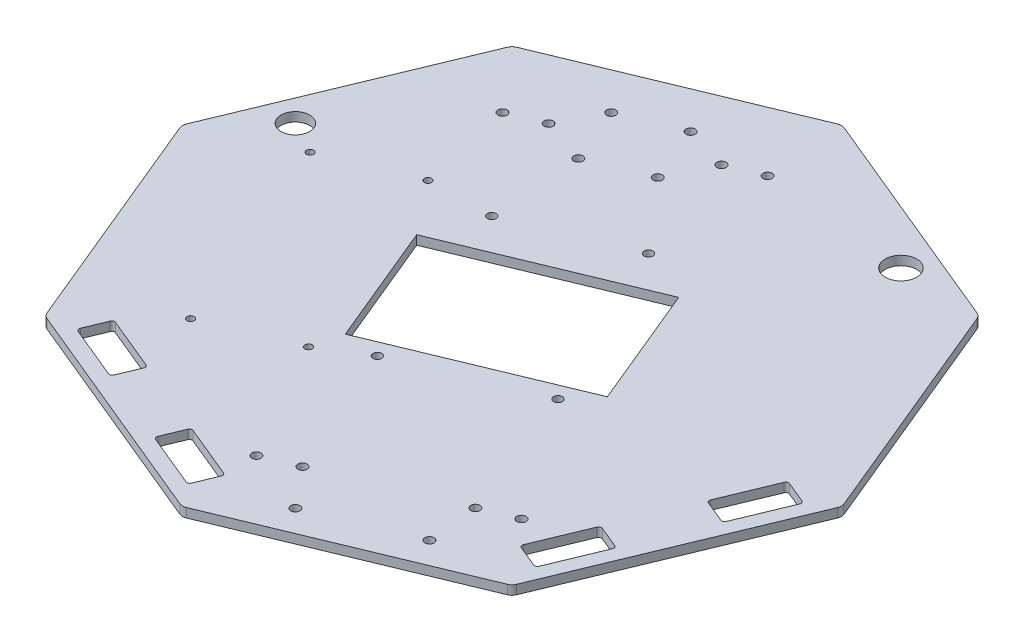
from build123d import *

# Parameters (mm, degrees)
BOSS_EXTRUDE1_DEPTH = 3.175
SKETCH2_R           = 1.6
CUT_EXTRUDE1_DEPTH  = 164.054057029
SKETCH3_R           = 5
SKETCH3_R_2         = 1.6
SKETCH3_R_3         = 5.5
CUT_EXTRUDE2_DEPTH  = 164.054057029
SKETCH5_R           = 1.524
CUT_EXTRUDE3_DEPTH  = 164.054057029
CUT_EXTRUDE4_DEPTH  = 164.054057029
SKETCH8_R           = 1.25
CUT_EXTRUDE5_DEPTH  = 164.054057029
SKETCH9_W           = 27.941695013
SKETCH9_H           = 13.477758771
SKETCH9_W_2         = 30.242775778
SKETCH9_H_2         = 17.203318106
SKETCH9_W_3         = 23.480845259
SKETCH9_H_3         = 15.425198082
SKETCH9_W_4         = 27.275197361
SKETCH9_H_4         = 16.833910872
BOSS_EXTRUDE2_DEPTH = 3.175
SKETCH16_R          = 1.6
CUT_EXTRUDE6_DEPTH  = 10
FILLET1_R           = 3
FILLET2_R           = 1


with BuildPart() as part:
    # Sketch1 → Boss-Extrude1 (new body)
    with BuildSketch(Plane(origin=(0, 0, 0), x_dir=(1, 0, 0), z_dir=(0, 1, 0))):
        Polygon((115.274769331, 0), (81.511571094, 81.511571094), (0, 115.274769331), (-81.511571094, 81.511571094), (-115.274769331, 0), (-81.511571094, -81.511571094), (0, -115.274769331), (81.511571094, -81.511571094), align=None)
    extrude(amount=BOSS_EXTRUDE1_DEPTH)

    # Sketch2 → Cut-Extrude1 (cut, through all)
    with BuildSketch(Plane(origin=(0, 3.175, 0), x_dir=(1, 0, 0), z_dir=(0, 1, 0))):
        with Locations(Location((-8.982761909, 81.788202013, 0), (0, 0, 270))):
            Circle(SKETCH2_R)
        with Locations(Location((3.951551546, 87.145770066, 0), (0, 0, 270))):
            Circle(SKETCH2_R)
        with Locations(Location((-64.41553386, 58.827196071, 0), (0, 0, 90))):
            Circle(SKETCH2_R)
        with Locations(Location((-51.481220405, 64.184764124, 0), (0, 0, 90))):
            Circle(SKETCH2_R)
        with Locations(Location((64.41553386, -58.827196071, 0), (0, 0, 90))):
            Circle(SKETCH2_R)
        with Locations(Location((51.481220405, -64.184764124, 0), (0, 0, 90))):
            Circle(SKETCH2_R)
        with Locations(Location((8.982761909, -81.788202013, 0), (0, 0, 270))):
            Circle(SKETCH2_R)
        with Locations(Location((-3.951551546, -87.145770066, 0), (0, 0, 270))):
            Circle(SKETCH2_R)
    extrude(amount=-CUT_EXTRUDE1_DEPTH, mode=Mode.SUBTRACT)

    # Sketch3 → Cut-Extrude2 (cut, through all)
    with BuildSketch(Plane(origin=(0, 3.175, 0), x_dir=(1, 0, 0), z_dir=(0, 1, 0))):
        with Locations(Location((-96.010047769, 20.377892773, 0), (0, 0, 270))):
            Circle(SKETCH3_R)
        with Locations(Location((20.377892773, -96.010047769, 0), (0, 0, 270))):
            Circle(SKETCH3_R_2)
        with Locations(Location((53.480009673, -82.298702006, 0), (0, 0, 90))):
            Circle(SKETCH3_R_2)
        with Locations(Location((-24.491739671, 86.844676056, 0), (0, 0, 270))):
            Circle(SKETCH3_R_2)
        with Locations(Location((-44.090184145, 78.726734554, 0), (0, 0, 90))):
            Circle(SKETCH3_R_2)
        with Locations(Location((-35.972242642, 59.128290081, 0), (0, 0, 270))):
            Circle(SKETCH3_R_2)
        with Locations(Location((-16.373798169, 67.246231583, 0), (0, 0, 90))):
            Circle(SKETCH3_R_2)
        with Locations(Location((53.480009673, 82.298702006, 0), (0, 0, 270))):
            Circle(SKETCH3_R_3)
        Polygon((-68.117650961, -70.823631462), (-71.944485285, -80.062426787), (-51.944485285, -88.346698034), (-48.117650961, -79.107902709), align=None)
        Polygon((-1.913417162, -98.246322988), (-5.740251485, -107.485118313), (-25.740251485, -99.200847065), (-21.913417162, -89.96205174), align=None)
        Polygon((88.346698034, -51.944485285), (80.062426787, -71.944485285), (70.823631462, -68.117650961), (79.107902709, -48.117650961), align=None)
        Polygon((98.246322988, -1.913417162), (107.485118313, -5.740251485), (99.200847066, -25.740251485), (89.96205174, -21.913417162), align=None)
    extrude(amount=-CUT_EXTRUDE2_DEPTH, mode=Mode.SUBTRACT)

    # Sketch5 → Cut-Extrude3 (cut, through all)
    with BuildSketch(Plane(origin=(0, 3.175, 0), x_dir=(1, 0, 0), z_dir=(0, 1, 0))):
        with Locations(Location((33.228392199, -17.165706419, 0), (0, 0, 270))):
            Circle(SKETCH5_R)
        with Locations(Location((-11.35803404, -35.634008864, 0), (0, 0, 270))):
            Circle(SKETCH5_R)
        with Locations(Location((-33.697130397, 26.59401536, 0), (0, 0, 270))):
            Circle(SKETCH5_R)
        with Locations(Location((5.02266081, 42.632278011, 0), (0, 0, 270))):
            Circle(SKETCH5_R)
    extrude(amount=-CUT_EXTRUDE3_DEPTH, mode=Mode.SUBTRACT)

    # Sketch6 → Cut-Extrude4 (cut, through all)
    with BuildSketch(Plane(origin=(0, 3.175, 0), x_dir=(1, 0, 0), z_dir=(0, 1, 0))):
        Polygon((41.137502582, -7.855309115), (23.534064693, 34.643149381), (-41.137502582, 7.855309115), (-23.534064693, -34.643149381), align=None)
    extrude(amount=-CUT_EXTRUDE4_DEPTH, mode=Mode.SUBTRACT)

    # Sketch8 → Cut-Extrude5 (cut, through all)
    with BuildSketch(Plane(origin=(0, 3.175, 0), x_dir=(1, 0, 0), z_dir=(0, 1, 0))):
        with Locations(Location((-55.208521245, -56.963472567, 0), (0, 0, 270))):
            Circle(SKETCH8_R)
        with Locations(Location((-26.106315971, -44.908944448, 0), (0, 0, 270))):
            Circle(SKETCH8_R)
        with Locations(Location((-84.675145537, 14.175251436, 0), (0, 0, 270))):
            Circle(SKETCH8_R)
        with Locations(Location((-55.572940263, 26.229779555, 0), (0, 0, 270))):
            Circle(SKETCH8_R)
    extrude(amount=-CUT_EXTRUDE5_DEPTH, mode=Mode.SUBTRACT)

    # Sketch9 → Boss-Extrude2 (add)
    with BuildSketch(Plane(origin=(0, 3.175, 0), x_dir=(1, 0, 0), z_dir=(0, 1, 0))):
        with Locations((-58.48921623, 61.487322726)):
            Rectangle(SKETCH9_W, SKETCH9_H)
        with Locations((3.475601533, 82.74492599)):
            Rectangle(SKETCH9_W_2, SKETCH9_H_2)
        with Locations((2.615763969, -84.269263782)):
            Rectangle(SKETCH9_W_3, SKETCH9_H_3)
        with Locations((52.818476628, -60.231828394)):
            Rectangle(SKETCH9_W_4, SKETCH9_H_4)
    extrude(amount=-BOSS_EXTRUDE2_DEPTH)

    # Sketch16 → Cut-Extrude6 (cut)
    with BuildSketch(Plane(origin=(0, 3.175, 0), x_dir=(1, 0, 0), z_dir=(0, 1, 0))):
        with Locations(Location((-51.719028062, 64.497570003, 0), (0, 0, 270))):
            Circle(SKETCH16_R)
        with Locations(Location((-63.082746312, 59.790563785, 0), (0, 0, 270))):
            Circle(SKETCH16_R)
        with Locations(Location((-9.03579366, 82.177544578, 0), (0, 0, 270))):
            Circle(SKETCH16_R)
        with Locations(Location((2.32792459, 86.884550796, 0), (0, 0, 270))):
            Circle(SKETCH16_R)
        with Locations(Location((63.082746312, -59.790563785, 0), (0, 0, 270))):
            Circle(SKETCH16_R)
        with Locations(Location((51.719028062, -64.497570003, 0), (0, 0, 270))):
            Circle(SKETCH16_R)
        with Locations(Location((9.03579366, -82.177544578, 0), (0, 0, 270))):
            Circle(SKETCH16_R)
        with Locations(Location((-2.32792459, -86.884550796, 0), (0, 0, 270))):
            Circle(SKETCH16_R)
    extrude(amount=-CUT_EXTRUDE6_DEPTH, mode=Mode.SUBTRACT)

    # Fillet1
    fillet1_edges = [part.edges().sort_by_distance(p)[0] for p in [
        (81.511571094, 1.5875, 81.511571094),
        (0, 1.5875, 115.274769331),
        (-81.511571094, 1.5875, 81.511571094),
        (-115.274769331, 1.5875, 0),
        (-81.511571094, 1.5875, -81.511571094),
        (0, 1.5875, -115.274769331),
        (81.511571094, 1.5875, -81.511571094),
        (115.274769331, 1.5875, 0),
    ]]
    fillet(fillet1_edges, radius=FILLET1_R)

    # Fillet2
    fillet2_edges = [part.edges().sort_by_distance(p)[0] for p in [
        (79.107902709, 1.5875, 48.117650961),
        (88.346698034, 1.5875, 51.944485285),
        (80.062426787, 1.5875, 71.944485285),
        (70.823631462, 1.5875, 68.117650961),
        (89.96205174, 1.5875, 21.913417162),
        (98.246322988, 1.5875, 1.913417162),
        (107.485118313, 1.5875, 5.740251485),
        (99.200847066, 1.5875, 25.740251485),
        (-51.944485285, 1.5875, 88.346698034),
        (-71.944485285, 1.5875, 80.062426787),
        (-68.117650961, 1.5875, 70.823631462),
        (-48.117650961, 1.5875, 79.107902709),
        (-21.913417162, 1.5875, 89.96205174),
        (-1.913417162, 1.5875, 98.246322988),
        (-5.740251485, 1.5875, 107.485118313),
        (-25.740251485, 1.5875, 99.200847065),
    ]]
    fillet(fillet2_edges, radius=FILLET2_R)


solid = part.part
